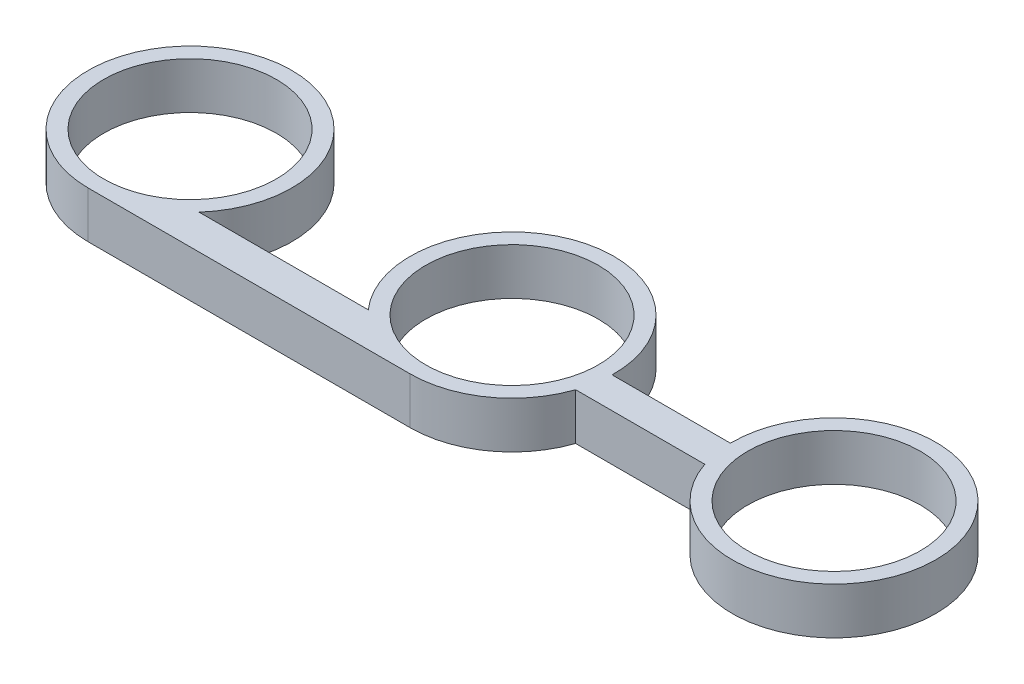
from build123d import *

# Parameters (mm, degrees)
SKETCH1_R           = 5
BOSS_EXTRUDE2_DEPTH = 2.7


with BuildPart() as part:
    # Sketch1 → Boss-Extrude2 (new body)
    with BuildSketch(Plane(origin=(0, 0, 0), x_dir=(1, 0, 0), z_dir=(0, 1, 0))):
        with BuildLine():
            Line((-18.65, -5.9), (0, -5.9))
            ThreePointArc((0, -5.9), (3.435112807, -4.796873982), (5.585696018, -1.9))
            Line((5.585696018, -1.9), (13.064303982, -1.9))
            ThreePointArc((13.064303982, -1.9), (24.462524087, 1.01220736), (12.750847518, -0.1))
            Line((12.750847518, -0.1), (5.899152482, -0.1))
            ThreePointArc((5.899152482, -0.1), (-2.037564557, 5.536996539), (-4.427188724, -3.9))
            Line((-4.427188724, -3.9), (-14.222811276, -3.9))
            ThreePointArc((-14.222811276, -3.9), (-21.07899156, 5.376802024), (-18.65, -5.9))
        make_face()
        with Locations(Location((0, 0, 0), (0, 0, 90))):
            Circle(SKETCH1_R, mode=Mode.SUBTRACT)
        with Locations(Location((18.65, 0, 0), (0, 0, 90))):
            Circle(SKETCH1_R, mode=Mode.SUBTRACT)
        with Locations(Location((-18.65, 0, 0), (0, 0, 90))):
            Circle(SKETCH1_R, mode=Mode.SUBTRACT)
    extrude(amount=BOSS_EXTRUDE2_DEPTH)


solid = part.part
